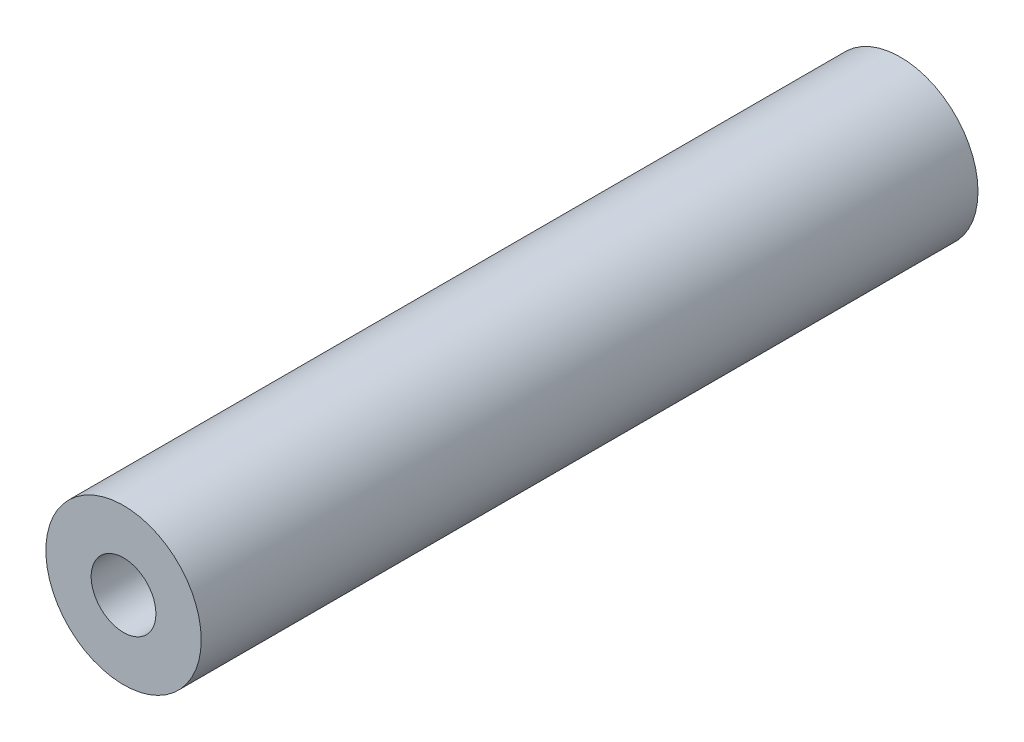
from build123d import *

# Parameters (mm, degrees)
SKETCH1_R           = 6
BOSS_EXTRUDE1_DEPTH = 30


with BuildPart() as part:
    # Sketch1 → Boss-Extrude1 (new body)
    with BuildSketch(Plane.XY):
        Circle(SKETCH1_R)
    boss_extrude1 = extrude(amount=-BOSS_EXTRUDE1_DEPTH)

    # Sketch5 → Tap Drill for M6x1.0 Tap1 (revolve, cut)
    with BuildSketch(Plane(origin=(0, 0, 0), x_dir=(0, -1, 0), z_dir=(1, 0, 0))):
        Polygon((0, 0), (0, 23.502151548), (2.5, 22), (2.5, 0), align=None)
    tap_drill_for_m6x1_0_tap1 = revolve(axis=Axis((0, 0, 6.35), (0, 0, -1)), mode=Mode.SUBTRACT)

    # Mirror1: Boss-Extrude1, Tap Drill for M6x1.0 Tap1 across plane
    add(boss_extrude1.mirror(Plane.XY.offset(-30)))
    add(tap_drill_for_m6x1_0_tap1.mirror(Plane.XY.offset(-30)), mode=Mode.SUBTRACT)


solid = part.part
